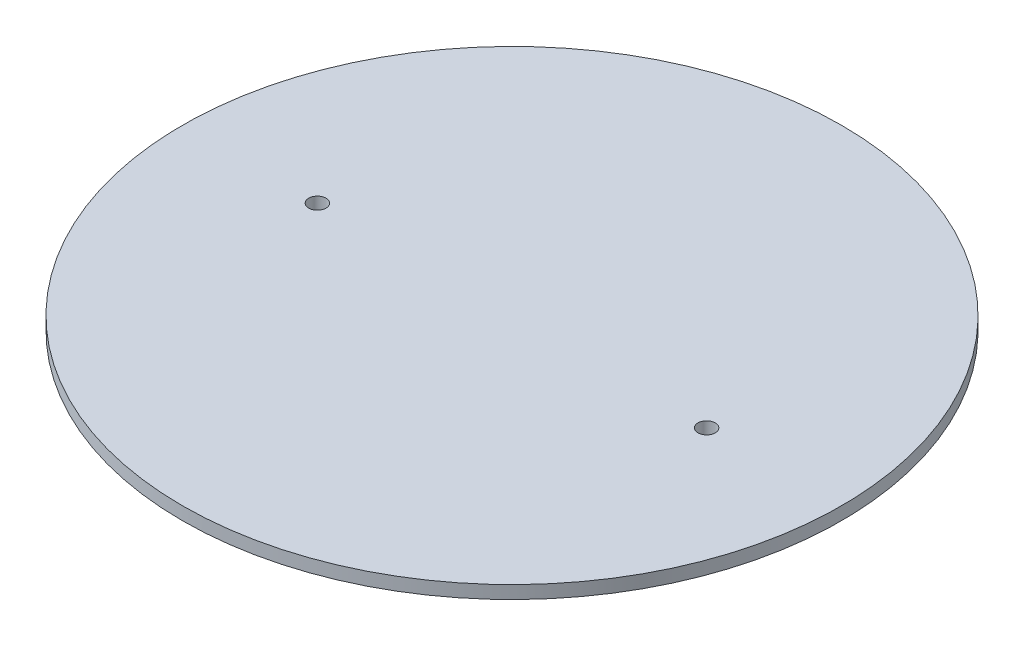
from build123d import *

# Parameters (mm, degrees)
SKETCH1_R           = 76.2
BOSS_EXTRUDE1_DEPTH = 3
SKETCH2_R           = 2
CUT_EXTRUDE1_DEPTH  = 10


with BuildPart() as part:
    # Sketch1 → Boss-Extrude1 (new body)
    with BuildSketch(Plane(origin=(0, 0, 0), x_dir=(1, 0, 0), z_dir=(0, 1, 0))):
        with Locations(Location((0, 0, 0), (0, 0, 270))):
            Circle(SKETCH1_R)
    extrude(amount=BOSS_EXTRUDE1_DEPTH)

    # Sketch2 → Cut-Extrude1 (cut)
    with BuildSketch(Plane(origin=(0, 3, 0), x_dir=(1, 0, 0), z_dir=(0, 1, 0))):
        with Locations(Location((-45, 0, 0), (0, 0, 270))):
            Circle(SKETCH2_R)
        with Locations(Location((45, 0, 0), (0, 0, 270))):
            Circle(SKETCH2_R)
    extrude(amount=-CUT_EXTRUDE1_DEPTH, mode=Mode.SUBTRACT)


solid = part.part
